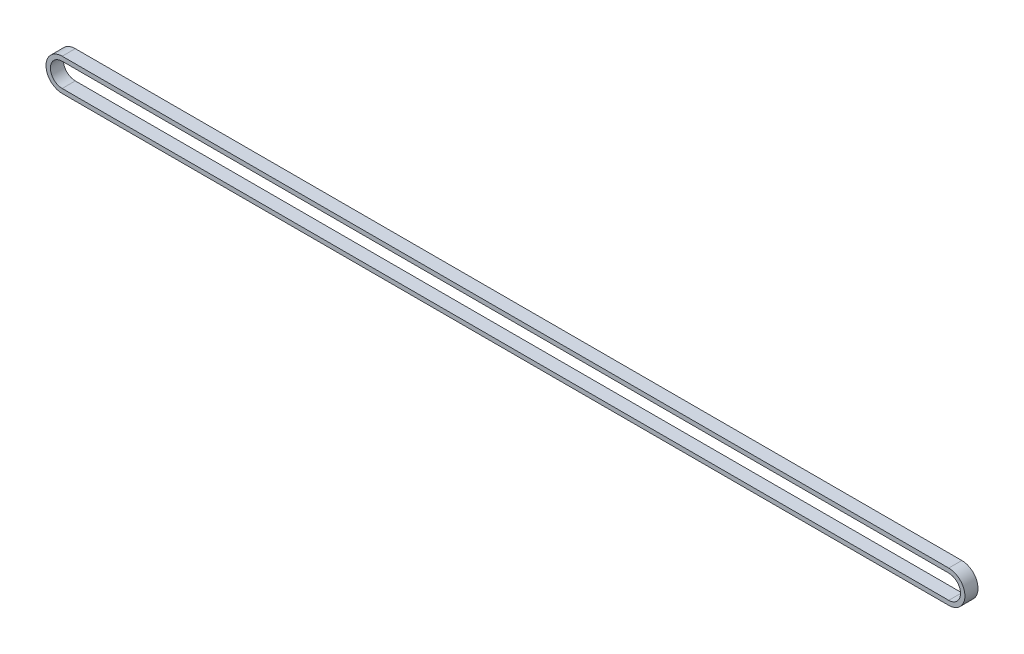
from build123d import *

# Parameters (mm, degrees)
RESSALTO_EXTRUS_O1_DEPTH = 3


with BuildPart() as part:
    # Esboço1 → Ressalto-extrusão1 (new, symmetric)
    with BuildSketch(Plane.XY):
        with BuildLine():
            ThreePointArc((203, -7.4), (210.4, 0), (203, 7.4))
            Line((203, 7.4), (-203, 7.4))
            ThreePointArc((-203, 7.4), (-210.4, 0), (-203, -7.4))
            Line((-203, -7.4), (203, -7.4))
        make_face()
        with BuildLine():
            Line((-203, 5.4), (203, 5.4))
            ThreePointArc((203, 5.4), (208.4, 0), (203, -5.4))
            Line((203, -5.4), (-203, -5.4))
            ThreePointArc((-203, -5.4), (-208.4, 0), (-203, 5.4))
        make_face(mode=Mode.SUBTRACT)
    extrude(amount=RESSALTO_EXTRUS_O1_DEPTH, both=True)


solid = part.part
